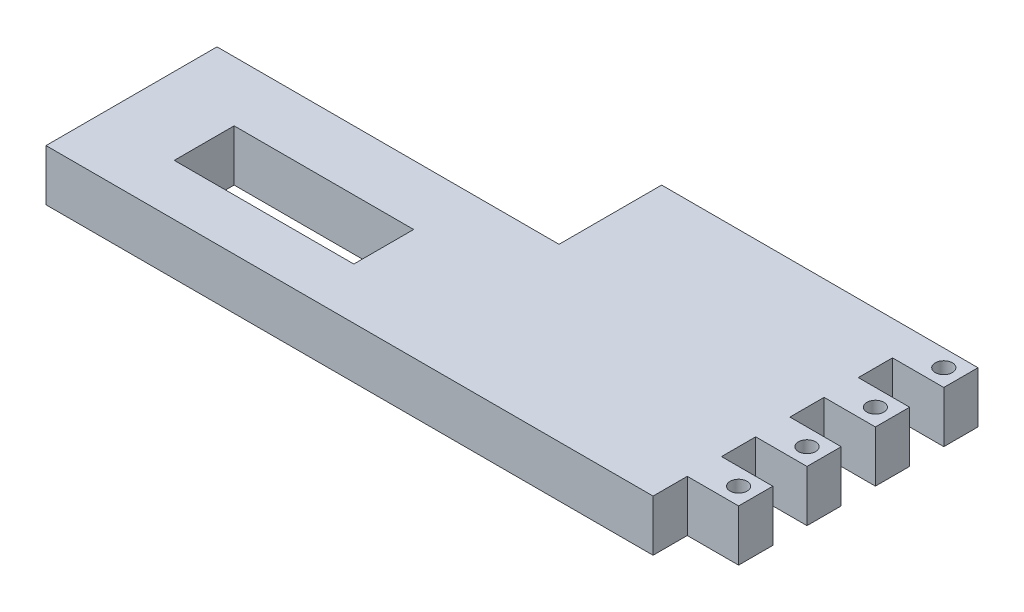
from build123d import *

# Parameters (mm, degrees)
BOSS_EXTRUDE1_DEPTH = 6
SKETCH2_W           = 21
SKETCH2_H           = 7
CUT_EXTRUDE1_DEPTH  = 46.122056691
SKETCH3_R           = 1
CUT_EXTRUDE2_DEPTH  = 46.122056691


with BuildPart() as part:
    # Sketch1 → Boss-Extrude1 (new body)
    with BuildSketch(Plane(origin=(0, 0, 0), x_dir=(1, 0, 0), z_dir=(0, 1, 0))):
        Polygon((-40, 0), (0, 0), (0, 12), (37, 12), (37, 8), (31, 8), (31, 4), (37, 4), (37, 0), (31, 0), (31, -4), (37, -4), (37, -8), (31, -8), (31, -12), (37, -12), (37, -16), (31, -16), (31, -20), (-40, -20), align=None)
    extrude(amount=BOSS_EXTRUDE1_DEPTH)

    # Sketch2 → Cut-Extrude1 (cut, through all)
    with BuildSketch(Plane(origin=(0, 6, 0), x_dir=(1, 0, 0), z_dir=(0, 1, 0))):
        with Locations((-20.5, -10.5)):
            Rectangle(SKETCH2_W, SKETCH2_H)
    extrude(amount=-CUT_EXTRUDE1_DEPTH, mode=Mode.SUBTRACT)

    # Sketch3 → Cut-Extrude2 (cut, through all)
    with BuildSketch(Plane(origin=(0, 6, 0), x_dir=(1, 0, 0), z_dir=(0, 1, 0))):
        with Locations(Location((35, 10, 0), (0, 0, 270))):
            Circle(SKETCH3_R)
        with Locations(Location((35, 2, 0), (0, 0, 270))):
            Circle(SKETCH3_R)
        with Locations(Location((35, -6, 0), (0, 0, 270))):
            Circle(SKETCH3_R)
        with Locations(Location((35, -14, 0), (0, 0, 270))):
            Circle(SKETCH3_R)
    extrude(amount=-CUT_EXTRUDE2_DEPTH, mode=Mode.SUBTRACT)


solid = part.part
